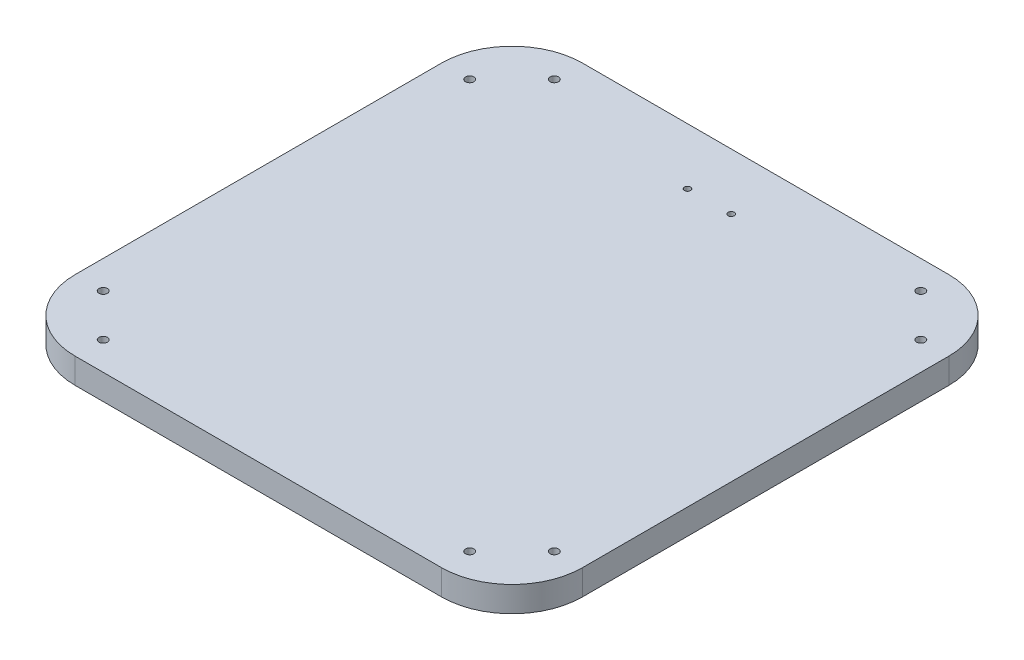
from build123d import *

# Parameters (mm, degrees)
BOSS_EXTRUDE1_DEPTH = 9
SKETCH2_R           = 1.09
CUT_EXTRUDE1_DEPTH  = 128.597021909
SKETCH3_R           = 1.5
CUT_EXTRUDE2_DEPTH  = 128.597021909


with BuildPart() as part:
    # Sketch1 → Boss-Extrude1 (new body)
    with BuildSketch(Plane(origin=(0, 0, 0), x_dir=(1, 0, 0), z_dir=(0, 1, 0))):
        with BuildLine():
            Line((-65, -90), (65, -90))
            ThreePointArc((65, -90), (82.67766953, -82.67766953), (90, -65))
            Line((90, -65), (90, 65))
            ThreePointArc((90, 65), (82.67766953, 82.67766953), (65, 90))
            Line((65, 90), (-65, 90))
            ThreePointArc((-65, 90), (-82.67766953, 82.67766953), (-90, 65))
            Line((-90, 65), (-90, -65))
            ThreePointArc((-90, -65), (-82.67766953, -82.67766953), (-65, -90))
        make_face()
    extrude(amount=BOSS_EXTRUDE1_DEPTH)

    # Sketch2 → Cut-Extrude1 (cut, through all)
    with BuildSketch(Plane(origin=(0, 9, 0), x_dir=(1, 0, 0), z_dir=(0, 1, 0))):
        with Locations(Location((-7.747, 70, 0), (0, 0, 270))):
            Circle(SKETCH2_R)
        with Locations(Location((7.747, 70, 0), (0, 0, 270))):
            Circle(SKETCH2_R)
    extrude(amount=-CUT_EXTRUDE1_DEPTH, mode=Mode.SUBTRACT)

    # Sketch3 → Cut-Extrude2 (cut, through all)
    with BuildSketch(Plane(origin=(0, 9, 0), x_dir=(1, 0, 0), z_dir=(0, 1, 0))):
        with Locations(Location((-65, 80, 0), (0, 0, 270))):
            Circle(SKETCH3_R)
        with Locations(Location((-80, 65, 0), (0, 0, 270))):
            Circle(SKETCH3_R)
        with Locations(Location((80, 65, 0), (0, 0, 270))):
            Circle(SKETCH3_R)
        with Locations(Location((80, -65, 0), (0, 0, 270))):
            Circle(SKETCH3_R)
        with Locations(Location((65, 80, 0), (0, 0, 270))):
            Circle(SKETCH3_R)
        with Locations(Location((65, -80, 0), (0, 0, 270))):
            Circle(SKETCH3_R)
        with Locations(Location((-65, -80, 0), (0, 0, 270))):
            Circle(SKETCH3_R)
        with Locations(Location((-80, -65, 0), (0, 0, 270))):
            Circle(SKETCH3_R)
    extrude(amount=-CUT_EXTRUDE2_DEPTH, mode=Mode.SUBTRACT)


solid = part.part
